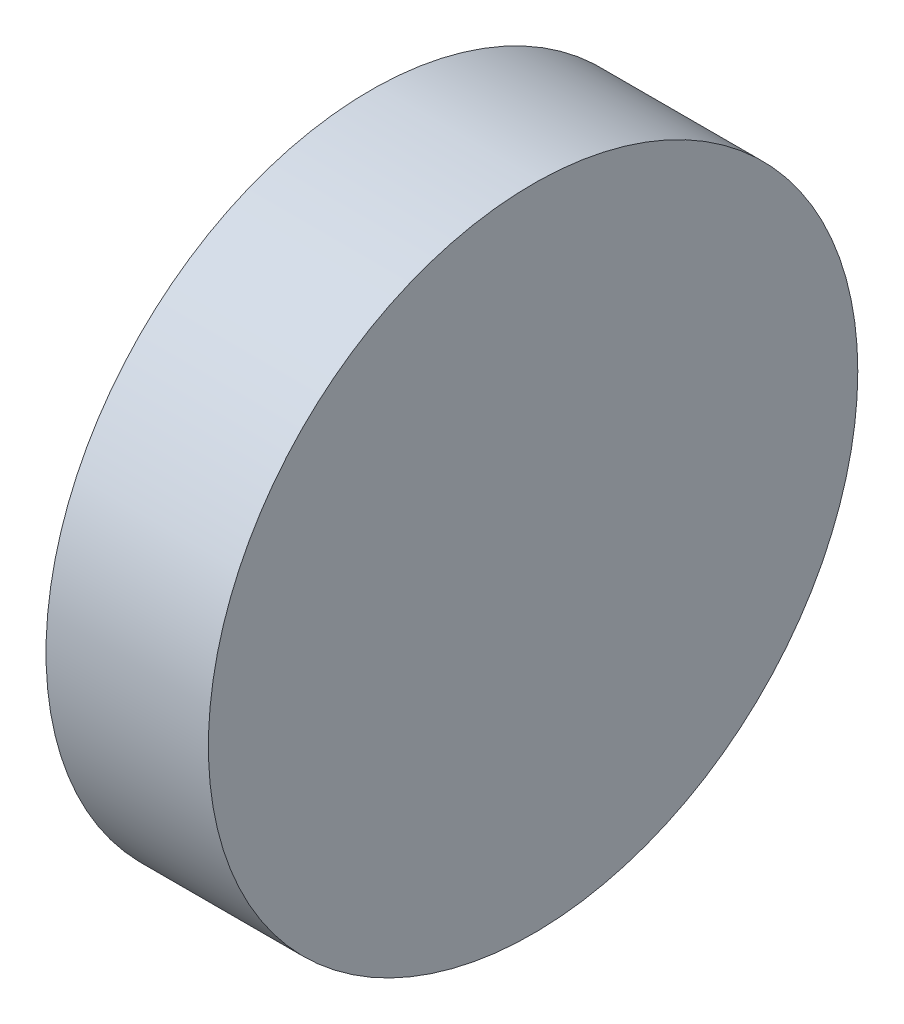
from build123d import *

# Parameters (mm, degrees)
SKETCH_1_R      = 200
EXTRUDE_1_DEPTH = 100


with BuildPart() as part:
    # 草图1 → 凸台-拉伸1 (new body)
    with BuildSketch(Plane(origin=(0, 0, 0), x_dir=(0, 0, -1), z_dir=(1, 0, 0))):
        Circle(SKETCH_1_R)
    extrude(amount=EXTRUDE_1_DEPTH)


solid = part.part
